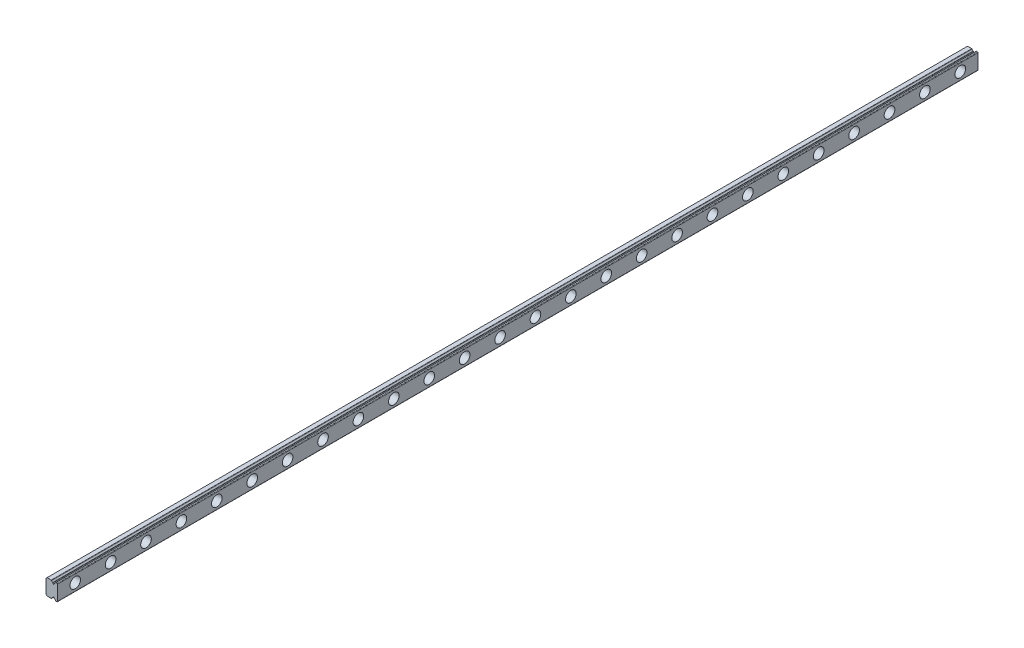
from build123d import *

# Parameters (mm, degrees)
EXTRUDE_1_DEPTH     = 400
SKETCH_2_R          = 3
CUT_EXTRUDE_1_DEPTH = 4.5
SKETCH_3_R          = 1.75
CUT_EXTRUDE_2_DEPTH = 401.126542484
CUT_EXTRUDE_4_DEPTH = 80
EXTRUDE_2_DEPTH     = 200
CUT_EXTRUDE_START   = -100
SKETCH_7_R          = 1.75
CUT_EXTRUDE_5_DEPTH = 100
SKETCH_8_R          = 3
CUT_EXTRUDE_6_DEPTH = 4.5


with BuildPart() as part:
    # 草图1 → 凸台-拉伸1 (new body)
    with BuildSketch(Plane.XY):
        with BuildLine():
            ThreePointArc((6.2, 9), (6.412132034, 8.912132034), (6.5, 8.7))
            Line((6.5, 8.7), (6.5, 0.3))
            ThreePointArc((6.5, 0.3), (6.412132034, 0.087867966), (6.2, 0))
            Line((6.2, 0), (5.557669683, 0))
            ThreePointArc((5.557669683, 0), (5.444280341, 0.035249106), (5.370859728, 0.128571429))
            ThreePointArc((5.370859728, 0.128571429), (5.130846451, 0.514929157), (4.764285714, 0.784209483))
            ThreePointArc((4.764285714, 0.784209483), (4.680969149, 0.858006567), (4.65, 0.964911064))
            Line((4.65, 0.964911064), (4.65, 1))
            ThreePointArc((4.65, 1), (4.25, 1.4), (3.85, 1))
            Line((3.85, 1), (3.85, 0.964911064))
            ThreePointArc((3.85, 0.964911064), (3.819030851, 0.858006567), (3.735714286, 0.784209483))
            ThreePointArc((3.735714286, 0.784209483), (3.369153549, 0.514929157), (3.129140272, 0.128571429))
            ThreePointArc((3.129140272, 0.128571429), (3.055719659, 0.035249106), (2.942330317, 0))
            Line((2.942330317, 0), (0.6, 0))
            Line((0.6, 0), (0, 0.6))
            Line((0, 0.6), (0, 8.4))
            Line((0, 8.4), (0.6, 9))
            Line((0.6, 9), (2.942330317, 9))
            ThreePointArc((2.942330317, 9), (3.055719659, 8.964750894), (3.129140272, 8.871428571))
            ThreePointArc((3.129140272, 8.871428571), (3.369153549, 8.485070843), (3.735714286, 8.215790517))
            ThreePointArc((3.735714286, 8.215790517), (3.819030851, 8.141993433), (3.85, 8.035088936))
            Line((3.85, 8.035088936), (3.85, 8))
            ThreePointArc((3.85, 8), (4.25, 7.6), (4.65, 8))
            Line((4.65, 8), (4.65, 8.035088936))
            ThreePointArc((4.65, 8.035088936), (4.680969149, 8.141993433), (4.764285714, 8.215790517))
            ThreePointArc((4.764285714, 8.215790517), (5.130846451, 8.485070843), (5.370859728, 8.871428571))
            ThreePointArc((5.370859728, 8.871428571), (5.444280341, 8.964750894), (5.557669683, 9))
            Line((5.557669683, 9), (6.2, 9))
        make_face()
    extrude(amount=EXTRUDE_1_DEPTH)

    # 草图2 → 切除-拉伸1 (cut)
    with BuildSketch(Plane(origin=(6.5, 0, 0), x_dir=(0, 0, -1), z_dir=(1, 0, 0))):
        with Locations((-10, 4.5)):
            Circle(SKETCH_2_R)
        with Locations((-30, 4.5)):
            Circle(SKETCH_2_R)
        with Locations((-50, 4.5)):
            Circle(SKETCH_2_R)
        with Locations((-70, 4.5)):
            Circle(SKETCH_2_R)
        with Locations((-90, 4.5)):
            Circle(SKETCH_2_R)
        with Locations((-110, 4.5)):
            Circle(SKETCH_2_R)
        with Locations((-130, 4.5)):
            Circle(SKETCH_2_R)
        with Locations((-150, 4.5)):
            Circle(SKETCH_2_R)
        with Locations((-170, 4.5)):
            Circle(SKETCH_2_R)
        with Locations((-190, 4.5)):
            Circle(SKETCH_2_R)
        with Locations((-210, 4.5)):
            Circle(SKETCH_2_R)
        with Locations((-230, 4.5)):
            Circle(SKETCH_2_R)
        with Locations((-250, 4.5)):
            Circle(SKETCH_2_R)
        with Locations((-270, 4.5)):
            Circle(SKETCH_2_R)
        with Locations((-290, 4.5)):
            Circle(SKETCH_2_R)
        with Locations((-310, 4.5)):
            Circle(SKETCH_2_R)
        with Locations((-330, 4.5)):
            Circle(SKETCH_2_R)
        with Locations((-350, 4.5)):
            Circle(SKETCH_2_R)
        with Locations((-370, 4.5)):
            Circle(SKETCH_2_R)
        with Locations((-390, 4.5)):
            Circle(SKETCH_2_R)
        with Locations((-410, 4.5)):
            Circle(SKETCH_2_R)
        with Locations((-430, 4.5)):
            Circle(SKETCH_2_R)
        with Locations((-450, 4.5)):
            Circle(SKETCH_2_R)
        with Locations((-470, 4.5)):
            Circle(SKETCH_2_R)
        with Locations((-490, 4.5)):
            Circle(SKETCH_2_R)
        with Locations((-510, 4.5)):
            Circle(SKETCH_2_R)
        with Locations((-530, 4.5)):
            Circle(SKETCH_2_R)
        with Locations((-550, 4.5)):
            Circle(SKETCH_2_R)
        with Locations((-570, 4.5)):
            Circle(SKETCH_2_R)
        with Locations((-590, 4.5)):
            Circle(SKETCH_2_R)
        with Locations((-610, 4.5)):
            Circle(SKETCH_2_R)
        with Locations((-630, 4.5)):
            Circle(SKETCH_2_R)
        with Locations((-650, 4.5)):
            Circle(SKETCH_2_R)
        with Locations((-670, 4.5)):
            Circle(SKETCH_2_R)
        with Locations((-690, 4.5)):
            Circle(SKETCH_2_R)
        with Locations((-710, 4.5)):
            Circle(SKETCH_2_R)
        with Locations((-730, 4.5)):
            Circle(SKETCH_2_R)
        with Locations((-750, 4.5)):
            Circle(SKETCH_2_R)
        with Locations((-770, 4.5)):
            Circle(SKETCH_2_R)
        with Locations((-790, 4.5)):
            Circle(SKETCH_2_R)
        with Locations((-810, 4.5)):
            Circle(SKETCH_2_R)
        with Locations((-830, 4.5)):
            Circle(SKETCH_2_R)
        with Locations((-850, 4.5)):
            Circle(SKETCH_2_R)
        with Locations((-870, 4.5)):
            Circle(SKETCH_2_R)
        with Locations((-890, 4.5)):
            Circle(SKETCH_2_R)
        with Locations((-910, 4.5)):
            Circle(SKETCH_2_R)
        with Locations((-930, 4.5)):
            Circle(SKETCH_2_R)
        with Locations((-950, 4.5)):
            Circle(SKETCH_2_R)
        with Locations((-970, 4.5)):
            Circle(SKETCH_2_R)
        with Locations((-990, 4.5)):
            Circle(SKETCH_2_R)
        with Locations((-1010, 4.5)):
            Circle(SKETCH_2_R)
        with Locations((-1030, 4.5)):
            Circle(SKETCH_2_R)
        with Locations((-1050, 4.5)):
            Circle(SKETCH_2_R)
        with Locations((-1070, 4.5)):
            Circle(SKETCH_2_R)
        with Locations((-1090, 4.5)):
            Circle(SKETCH_2_R)
        with Locations((-1110, 4.5)):
            Circle(SKETCH_2_R)
        with Locations((-1130, 4.5)):
            Circle(SKETCH_2_R)
        with Locations((-1150, 4.5)):
            Circle(SKETCH_2_R)
        with Locations((-1170, 4.5)):
            Circle(SKETCH_2_R)
        with Locations((-1190, 4.5)):
            Circle(SKETCH_2_R)
        with Locations((-1210, 4.5)):
            Circle(SKETCH_2_R)
        with Locations((-1230, 4.5)):
            Circle(SKETCH_2_R)
        with Locations((-1250, 4.5)):
            Circle(SKETCH_2_R)
        with Locations((-1270, 4.5)):
            Circle(SKETCH_2_R)
        with Locations((-1290, 4.5)):
            Circle(SKETCH_2_R)
        with Locations((-1310, 4.5)):
            Circle(SKETCH_2_R)
        with Locations((-1330, 4.5)):
            Circle(SKETCH_2_R)
        with Locations((-1350, 4.5)):
            Circle(SKETCH_2_R)
        with Locations((-1370, 4.5)):
            Circle(SKETCH_2_R)
        with Locations((-1390, 4.5)):
            Circle(SKETCH_2_R)
        with Locations((-1410, 4.5)):
            Circle(SKETCH_2_R)
        with Locations((-1430, 4.5)):
            Circle(SKETCH_2_R)
        with Locations((-1450, 4.5)):
            Circle(SKETCH_2_R)
        with Locations((-1470, 4.5)):
            Circle(SKETCH_2_R)
        with Locations((-1490, 4.5)):
            Circle(SKETCH_2_R)
        with Locations((-1510, 4.5)):
            Circle(SKETCH_2_R)
        with Locations((-1530, 4.5)):
            Circle(SKETCH_2_R)
        with Locations((-1550, 4.5)):
            Circle(SKETCH_2_R)
        with Locations((-1570, 4.5)):
            Circle(SKETCH_2_R)
        with Locations((-1590, 4.5)):
            Circle(SKETCH_2_R)
        with Locations((-1610, 4.5)):
            Circle(SKETCH_2_R)
        with Locations((-1630, 4.5)):
            Circle(SKETCH_2_R)
        with Locations((-1650, 4.5)):
            Circle(SKETCH_2_R)
        with Locations((-1670, 4.5)):
            Circle(SKETCH_2_R)
        with Locations((-1690, 4.5)):
            Circle(SKETCH_2_R)
        with Locations((-1710, 4.5)):
            Circle(SKETCH_2_R)
        with Locations((-1730, 4.5)):
            Circle(SKETCH_2_R)
        with Locations((-1750, 4.5)):
            Circle(SKETCH_2_R)
        with Locations((-1770, 4.5)):
            Circle(SKETCH_2_R)
        with Locations((-1790, 4.5)):
            Circle(SKETCH_2_R)
        with Locations((-1810, 4.5)):
            Circle(SKETCH_2_R)
        with Locations((-1830, 4.5)):
            Circle(SKETCH_2_R)
        with Locations((-1850, 4.5)):
            Circle(SKETCH_2_R)
        with Locations((-1870, 4.5)):
            Circle(SKETCH_2_R)
        with Locations((-1890, 4.5)):
            Circle(SKETCH_2_R)
        with Locations((-1910, 4.5)):
            Circle(SKETCH_2_R)
        with Locations((-1930, 4.5)):
            Circle(SKETCH_2_R)
        with Locations((-1950, 4.5)):
            Circle(SKETCH_2_R)
        with Locations((-1970, 4.5)):
            Circle(SKETCH_2_R)
        with Locations((-1990, 4.5)):
            Circle(SKETCH_2_R)
        with Locations((-2010, 4.5)):
            Circle(SKETCH_2_R)
        with Locations((-2030, 4.5)):
            Circle(SKETCH_2_R)
        with Locations((-2050, 4.5)):
            Circle(SKETCH_2_R)
        with Locations((-2070, 4.5)):
            Circle(SKETCH_2_R)
        with Locations((-2090, 4.5)):
            Circle(SKETCH_2_R)
        with Locations((-2110, 4.5)):
            Circle(SKETCH_2_R)
        with Locations((-2130, 4.5)):
            Circle(SKETCH_2_R)
        with Locations((-2150, 4.5)):
            Circle(SKETCH_2_R)
        with Locations((-2170, 4.5)):
            Circle(SKETCH_2_R)
        with Locations((-2190, 4.5)):
            Circle(SKETCH_2_R)
        with Locations((-2210, 4.5)):
            Circle(SKETCH_2_R)
        with Locations((-2230, 4.5)):
            Circle(SKETCH_2_R)
        with Locations((-2250, 4.5)):
            Circle(SKETCH_2_R)
        with Locations((-2270, 4.5)):
            Circle(SKETCH_2_R)
        with Locations((-2290, 4.5)):
            Circle(SKETCH_2_R)
        with Locations((-2310, 4.5)):
            Circle(SKETCH_2_R)
        with Locations((-2330, 4.5)):
            Circle(SKETCH_2_R)
        with Locations((-2350, 4.5)):
            Circle(SKETCH_2_R)
        with Locations((-2370, 4.5)):
            Circle(SKETCH_2_R)
        with Locations((-2390, 4.5)):
            Circle(SKETCH_2_R)
        with Locations((-2410, 4.5)):
            Circle(SKETCH_2_R)
        with Locations((-2430, 4.5)):
            Circle(SKETCH_2_R)
        with Locations((-2450, 4.5)):
            Circle(SKETCH_2_R)
        with Locations((-2470, 4.5)):
            Circle(SKETCH_2_R)
    extrude(amount=-CUT_EXTRUDE_1_DEPTH, mode=Mode.SUBTRACT)

    # 草图3 → 切除-拉伸2 (cut, through all)
    with BuildSketch(Plane(origin=(2, 0, 0), x_dir=(0, 0, -1), z_dir=(1, 0, 0))):
        with Locations((-10, 4.5)):
            Circle(SKETCH_3_R)
        with Locations((-30, 4.5)):
            Circle(SKETCH_3_R)
        with Locations((-50, 4.5)):
            Circle(SKETCH_3_R)
        with Locations((-70, 4.5)):
            Circle(SKETCH_3_R)
        with Locations((-90, 4.5)):
            Circle(SKETCH_3_R)
        with Locations((-110, 4.5)):
            Circle(SKETCH_3_R)
        with Locations((-130, 4.5)):
            Circle(SKETCH_3_R)
        with Locations((-150, 4.5)):
            Circle(SKETCH_3_R)
        with Locations((-170, 4.5)):
            Circle(SKETCH_3_R)
        with Locations((-190, 4.5)):
            Circle(SKETCH_3_R)
        with Locations((-210, 4.5)):
            Circle(SKETCH_3_R)
        with Locations((-230, 4.5)):
            Circle(SKETCH_3_R)
        with Locations((-250, 4.5)):
            Circle(SKETCH_3_R)
        with Locations((-270, 4.5)):
            Circle(SKETCH_3_R)
        with Locations((-290, 4.5)):
            Circle(SKETCH_3_R)
        with Locations((-310, 4.5)):
            Circle(SKETCH_3_R)
        with Locations((-330, 4.5)):
            Circle(SKETCH_3_R)
        with Locations((-350, 4.5)):
            Circle(SKETCH_3_R)
        with Locations((-370, 4.5)):
            Circle(SKETCH_3_R)
        with Locations((-390, 4.5)):
            Circle(SKETCH_3_R)
        with Locations((-410, 4.5)):
            Circle(SKETCH_3_R)
        with Locations((-430, 4.5)):
            Circle(SKETCH_3_R)
        with Locations((-450, 4.5)):
            Circle(SKETCH_3_R)
        with Locations((-470, 4.5)):
            Circle(SKETCH_3_R)
        with Locations((-490, 4.5)):
            Circle(SKETCH_3_R)
        with Locations((-510, 4.5)):
            Circle(SKETCH_3_R)
        with Locations((-530, 4.5)):
            Circle(SKETCH_3_R)
        with Locations((-550, 4.5)):
            Circle(SKETCH_3_R)
        with Locations((-570, 4.5)):
            Circle(SKETCH_3_R)
        with Locations((-590, 4.5)):
            Circle(SKETCH_3_R)
        with Locations((-610, 4.5)):
            Circle(SKETCH_3_R)
        with Locations((-630, 4.5)):
            Circle(SKETCH_3_R)
        with Locations((-650, 4.5)):
            Circle(SKETCH_3_R)
        with Locations((-670, 4.5)):
            Circle(SKETCH_3_R)
        with Locations((-690, 4.5)):
            Circle(SKETCH_3_R)
        with Locations((-710, 4.5)):
            Circle(SKETCH_3_R)
        with Locations((-730, 4.5)):
            Circle(SKETCH_3_R)
        with Locations((-750, 4.5)):
            Circle(SKETCH_3_R)
        with Locations((-770, 4.5)):
            Circle(SKETCH_3_R)
        with Locations((-790, 4.5)):
            Circle(SKETCH_3_R)
        with Locations((-810, 4.5)):
            Circle(SKETCH_3_R)
        with Locations((-830, 4.5)):
            Circle(SKETCH_3_R)
        with Locations((-850, 4.5)):
            Circle(SKETCH_3_R)
        with Locations((-870, 4.5)):
            Circle(SKETCH_3_R)
        with Locations((-890, 4.5)):
            Circle(SKETCH_3_R)
        with Locations((-910, 4.5)):
            Circle(SKETCH_3_R)
        with Locations((-930, 4.5)):
            Circle(SKETCH_3_R)
        with Locations((-950, 4.5)):
            Circle(SKETCH_3_R)
        with Locations((-970, 4.5)):
            Circle(SKETCH_3_R)
        with Locations((-990, 4.5)):
            Circle(SKETCH_3_R)
        with Locations((-1010, 4.5)):
            Circle(SKETCH_3_R)
        with Locations((-1030, 4.5)):
            Circle(SKETCH_3_R)
        with Locations((-1050, 4.5)):
            Circle(SKETCH_3_R)
        with Locations((-1070, 4.5)):
            Circle(SKETCH_3_R)
    extrude(amount=-CUT_EXTRUDE_2_DEPTH, mode=Mode.SUBTRACT)

    # 草图5 → 切除-拉伸4 (cut)
    with BuildSketch(Plane(origin=(0, 0, 0), x_dir=(-1, 0, 0), z_dir=(0, 0, -1))):
        with BuildLine():
            Line((-6.5, 8.7), (-6.5, 0.3))
            ThreePointArc((-6.5, 0.3), (-6.412132034, 0.087867966), (-6.2, 0))
            Line((-6.2, 0), (-5.557669683, 0))
            ThreePointArc((-5.557669683, 0), (-5.444280341, 0.035249106), (-5.370859728, 0.128571429))
            ThreePointArc((-5.370859728, 0.128571429), (-5.130846451, 0.514929157), (-4.764285714, 0.784209483))
            ThreePointArc((-4.764285714, 0.784209483), (-4.680969149, 0.858006567), (-4.65, 0.964911064))
            Line((-4.65, 0.964911064), (-4.65, 1))
            ThreePointArc((-4.65, 1), (-4.25, 1.4), (-3.85, 1))
            Line((-3.85, 1), (-3.85, 0.964911064))
            ThreePointArc((-3.85, 0.964911064), (-3.819030851, 0.858006567), (-3.735714286, 0.784209483))
            ThreePointArc((-3.735714286, 0.784209483), (-3.369153549, 0.514929157), (-3.129140272, 0.128571429))
            ThreePointArc((-3.129140272, 0.128571429), (-3.055719659, 0.035249106), (-2.942330317, 0))
            Line((-2.942330317, 0), (-0.6, 0))
            Line((-0.6, 0), (0, 0.6))
            Line((0, 0.6), (0, 8.4))
            Line((0, 8.4), (-0.6, 9))
            Line((-0.6, 9), (-2.942330317, 9))
            ThreePointArc((-2.942330317, 9), (-3.055719659, 8.964750894), (-3.129140272, 8.871428571))
            ThreePointArc((-3.129140272, 8.871428571), (-3.369153549, 8.485070843), (-3.735714286, 8.215790517))
            ThreePointArc((-3.735714286, 8.215790517), (-3.819030851, 8.141993433), (-3.85, 8.035088936))
            Line((-3.85, 8.035088936), (-3.85, 8))
            ThreePointArc((-3.85, 8), (-4.25, 7.6), (-4.65, 8))
            Line((-4.65, 8), (-4.65, 8.035088936))
            ThreePointArc((-4.65, 8.035088936), (-4.680969149, 8.141993433), (-4.764285714, 8.215790517))
            ThreePointArc((-4.764285714, 8.215790517), (-5.130846451, 8.485070843), (-5.370859728, 8.871428571))
            ThreePointArc((-5.370859728, 8.871428571), (-5.444280341, 8.964750894), (-5.557669683, 9))
            Line((-5.557669683, 9), (-6.2, 9))
            ThreePointArc((-6.2, 9), (-6.412132034, 8.912132034), (-6.5, 8.7))
        make_face()
    extrude(amount=-CUT_EXTRUDE_4_DEPTH, mode=Mode.SUBTRACT)

    # 草图6 → 凸台-拉伸2 (add)
    with BuildSketch(Plane.XY.offset(400)):
        with BuildLine():
            Line((6.2, 9), (5.557669683, 9))
            ThreePointArc((5.557669683, 9), (5.444280341, 8.964750894), (5.370859728, 8.871428571))
            ThreePointArc((5.370859728, 8.871428571), (5.130846451, 8.485070843), (4.764285714, 8.215790517))
            ThreePointArc((4.764285714, 8.215790517), (4.680969149, 8.141993433), (4.65, 8.035088936))
            Line((4.65, 8.035088936), (4.65, 8))
            ThreePointArc((4.65, 8), (4.25, 7.6), (3.85, 8))
            Line((3.85, 8), (3.85, 8.035088936))
            ThreePointArc((3.85, 8.035088936), (3.819030851, 8.141993433), (3.735714286, 8.215790517))
            ThreePointArc((3.735714286, 8.215790517), (3.369153549, 8.485070843), (3.129140272, 8.871428571))
            ThreePointArc((3.129140272, 8.871428571), (3.055719659, 8.964750894), (2.942330317, 9))
            Line((2.942330317, 9), (0.6, 9))
            Line((0.6, 9), (0, 8.4))
            Line((0, 8.4), (0, 0.6))
            Line((0, 0.6), (0.6, 0))
            Line((0.6, 0), (2.942330317, 0))
            ThreePointArc((2.942330317, 0), (3.055719659, 0.035249106), (3.129140272, 0.128571429))
            ThreePointArc((3.129140272, 0.128571429), (3.369153549, 0.514929157), (3.735714286, 0.784209483))
            ThreePointArc((3.735714286, 0.784209483), (3.819030851, 0.858006567), (3.85, 0.964911064))
            Line((3.85, 0.964911064), (3.85, 1))
            ThreePointArc((3.85, 1), (4.25, 1.4), (4.65, 1))
            Line((4.65, 1), (4.65, 0.964911064))
            ThreePointArc((4.65, 0.964911064), (4.680969149, 0.858006567), (4.764285714, 0.784209483))
            ThreePointArc((4.764285714, 0.784209483), (5.130846451, 0.514929157), (5.370859728, 0.128571429))
            ThreePointArc((5.370859728, 0.128571429), (5.444280341, 0.035249106), (5.557669683, 0))
            Line((5.557669683, 0), (6.2, 0))
            ThreePointArc((6.2, 0), (6.412132034, 0.087867966), (6.5, 0.3))
            Line((6.5, 0.3), (6.5, 8.7))
            ThreePointArc((6.5, 8.7), (6.412132034, 8.912132034), (6.2, 9))
        make_face()
    extrude(amount=EXTRUDE_2_DEPTH)

    # 草图7 → 切除-拉伸5 (cut)
    with BuildSketch(Plane.ZY.offset(CUT_EXTRUDE_START)):
        with Locations(Location((390, 4.5, 0), (0, 0, 180))):
            Circle(SKETCH_7_R)
        with Locations(Location((410, 4.5, 0), (0, 0, 270))):
            Circle(SKETCH_7_R)
        with Locations(Location((430, 4.5, 0), (0, 0, 270))):
            Circle(SKETCH_7_R)
        with Locations(Location((450, 4.5, 0), (0, 0, 270))):
            Circle(SKETCH_7_R)
        with Locations(Location((470, 4.5, 0), (0, 0, 270))):
            Circle(SKETCH_7_R)
        with Locations(Location((490, 4.5, 0), (0, 0, 270))):
            Circle(SKETCH_7_R)
        with Locations(Location((510, 4.5, 0), (0, 0, 270))):
            Circle(SKETCH_7_R)
        with Locations(Location((530, 4.5, 0), (0, 0, 270))):
            Circle(SKETCH_7_R)
        with Locations(Location((550, 4.5, 0), (0, 0, 270))):
            Circle(SKETCH_7_R)
        with Locations(Location((570, 4.5, 0), (0, 0, 270))):
            Circle(SKETCH_7_R)
        with Locations(Location((590, 4.5, 0), (0, 0, 270))):
            Circle(SKETCH_7_R)
    extrude(amount=CUT_EXTRUDE_5_DEPTH, mode=Mode.SUBTRACT)

    # 草图8 → 切除-拉伸6 (cut)
    with BuildSketch(Plane(origin=(6.5, 0, 0), x_dir=(0, 0, -1), z_dir=(1, 0, 0))):
        with Locations((-390, 4.5)):
            Circle(SKETCH_8_R)
        with Locations(Location((-410, 4.5, 0), (0, 0, 90))):
            Circle(SKETCH_8_R)
        with Locations(Location((-430, 4.5, 0), (0, 0, 90))):
            Circle(SKETCH_8_R)
        with Locations(Location((-450, 4.5, 0), (0, 0, 90))):
            Circle(SKETCH_8_R)
        with Locations(Location((-470, 4.5, 0), (0, 0, 90))):
            Circle(SKETCH_8_R)
        with Locations(Location((-490, 4.5, 0), (0, 0, 90))):
            Circle(SKETCH_8_R)
        with Locations(Location((-510, 4.5, 0), (0, 0, 90))):
            Circle(SKETCH_8_R)
        with Locations(Location((-530, 4.5, 0), (0, 0, 90))):
            Circle(SKETCH_8_R)
        with Locations(Location((-550, 4.5, 0), (0, 0, 90))):
            Circle(SKETCH_8_R)
        with Locations(Location((-570, 4.5, 0), (0, 0, 90))):
            Circle(SKETCH_8_R)
        with Locations(Location((-590, 4.5, 0), (0, 0, 90))):
            Circle(SKETCH_8_R)
    extrude(amount=-CUT_EXTRUDE_6_DEPTH, mode=Mode.SUBTRACT)


solid = part.part
